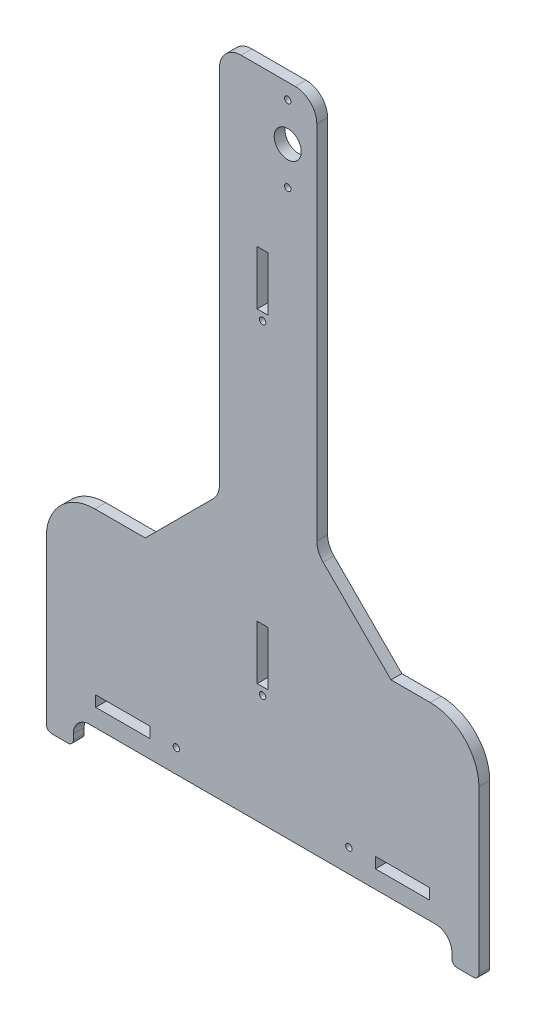
from build123d import *

# Parameters (mm, degrees)
SKETCH1_R           = 1.5
SKETCH1_R_2         = 6.35
SKETCH1_W           = 25.4
SKETCH1_H           = 5.08
SKETCH1_W_2         = 5.08
SKETCH1_H_2         = 25.4
BOSS_EXTRUDE1_DEPTH = 5.08


with BuildPart() as part:
    # Sketch1 → Boss-Extrude1 (new body)
    with BuildSketch(Plane.XY):
        with BuildLine():
            Line((-51.040787545, -12.415612204), (-51.040787545, -9.875612204))
            ThreePointArc((-51.040787545, -9.875612204), (-48.808941218, -4.487458531), (-43.420787545, -2.255612204))
            Line((-43.420787545, -2.255612204), (119.139212455, -2.255612204))
            ThreePointArc((119.139212455, -2.255612204), (124.527366128, -4.487458531), (126.759212455, -9.875612204))
            Line((126.759212455, -9.875612204), (126.759212455, -12.415612204))
            ThreePointArc((126.759212455, -12.415612204), (127.503161231, -14.211663428), (129.299212455, -14.955612204))
            Line((129.299212455, -14.955612204), (136.919212455, -14.955612204))
            ThreePointArc((136.919212455, -14.955612204), (138.715263679, -14.211663428), (139.459212455, -12.415612204))
            Line((139.459212455, -12.415612204), (139.459212455, 63.784387796))
            ThreePointArc((139.459212455, 63.784387796), (132.763673473, 79.948848814), (116.599212455, 86.644387796))
            Line((116.599212455, 86.644387796), (98.187659058, 86.644387796))
            Line((98.187659058, 86.644387796), (66.292302759, 118.539744095))
            ThreePointArc((66.292302759, 118.539744095), (64.089891606, 121.835885319), (63.316507656, 125.723948992))
            Line((63.316507656, 125.723948992), (63.316507656, 295.368236906))
            ThreePointArc((63.316507656, 295.368236906), (60.340712553, 302.552441803), (53.156507656, 305.528236906))
            Line((53.156507656, 305.528236906), (27.774726543, 305.528236906))
            ThreePointArc((27.774726543, 305.528236906), (20.590521646, 302.552441803), (17.614726543, 295.368236906))
            Line((17.614726543, 295.368236906), (17.614726543, 125.723948992))
            ThreePointArc((17.614726543, 125.723948992), (16.841342593, 121.835885319), (14.63893144, 118.539744095))
            Line((14.63893144, 118.539744095), (-17.256424859, 86.644387796))
            Line((-17.256424859, 86.644387796), (-40.880787545, 86.644387796))
            ThreePointArc((-40.880787545, 86.644387796), (-57.045248563, 79.948848814), (-63.740787545, 63.784387796))
            Line((-63.740787545, 63.784387796), (-63.740787545, -12.415612204))
            ThreePointArc((-63.740787545, -12.415612204), (-62.996838769, -14.211663428), (-61.200787545, -14.955612204))
            Line((-61.200787545, -14.955612204), (-53.580787545, -14.955612204))
            ThreePointArc((-53.580787545, -14.955612204), (-51.784736321, -14.211663428), (-51.040787545, -12.415612204))
        make_face()
        with Locations((37.859212455, 50.082420202)):
            Circle(SKETCH1_R, mode=Mode.SUBTRACT)
        with Locations((78.378833182, 8.65637608)):
            Circle(SKETCH1_R, mode=Mode.SUBTRACT)
        with Locations(Location((-2.660408273, 8.65637608, 0), (0, 0, 180))):
            Circle(SKETCH1_R, mode=Mode.SUBTRACT)
        with Locations((49.670678041, 298.310354304)):
            Circle(SKETCH1_R, mode=Mode.SUBTRACT)
        with Locations((49.670678041, 262.606350585)):
            Circle(SKETCH1_R, mode=Mode.SUBTRACT)
        with Locations((49.670678041, 280.294601083)):
            Circle(SKETCH1_R_2, mode=Mode.SUBTRACT)
        with Locations((37.859212455, 202.482420202)):
            Circle(SKETCH1_R, mode=Mode.SUBTRACT)
        with Locations((103.536086771, 8.65637608)):
            Rectangle(SKETCH1_W, SKETCH1_H, mode=Mode.SUBTRACT)
        with Locations((-27.817661861, 8.65637608)):
            Rectangle(SKETCH1_W, SKETCH1_H, mode=Mode.SUBTRACT)
        with Locations((37.859212455, 66.389058861)):
            Rectangle(SKETCH1_W_2, SKETCH1_H_2, mode=Mode.SUBTRACT)
        with Locations((37.859212455, 218.789058861)):
            Rectangle(SKETCH1_W_2, SKETCH1_H_2, mode=Mode.SUBTRACT)
    extrude(amount=BOSS_EXTRUDE1_DEPTH)


solid = part.part
